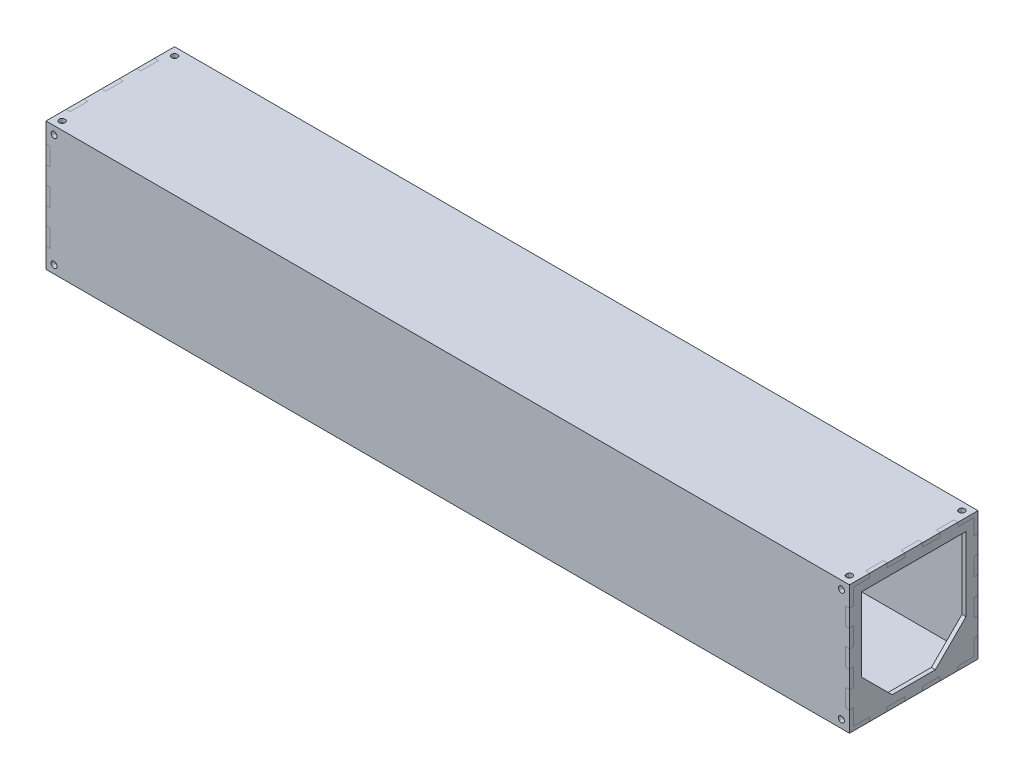
from build123d import *

# Parameters (mm, degrees)
SKETCH1_W           = 101.6
SKETCH1_H           = 101.6
SKETCH1_W_2         = 95.25
SKETCH1_H_2         = 95.25
BOSS_EXTRUDE1_DEPTH = 628.65
SKETCH3_W           = 13.97
SKETCH3_H           = 3.175
SKETCH3_W_2         = 3.175
SKETCH3_H_2         = 13.97
BOSS_EXTRUDE3_DEPTH = 3.175
SKETCH4_W           = 13.97
SKETCH4_H           = 3.175
SKETCH4_W_2         = 3.175
SKETCH4_H_2         = 13.97
BOSS_EXTRUDE4_DEPTH = 3.175
SKETCH5_W           = 95.25
SKETCH5_H           = 95.25
SKETCH5_W_2         = 3.175
SKETCH5_H_2         = 13.97
SKETCH5_W_3         = 13.97
SKETCH5_H_3         = 3.175
BOSS_EXTRUDE5_DEPTH = 3.175
SKETCH6_W           = 3.175
SKETCH6_H           = 13.97
SKETCH6_W_2         = 13.97
SKETCH6_H_2         = 3.175
BOSS_EXTRUDE6_DEPTH = 3.175
SKETCH7_R           = 2.38125
CUT_EXTRUDE1_DEPTH  = 648.956750582
SKETCH8_R           = 2.38125
CUT_EXTRUDE2_DEPTH  = 648.956750582


with BuildPart() as part:
    # Sketch1 → Boss-Extrude1 (new body)
    with BuildSketch(Plane(origin=(0, 0, 0), x_dir=(0, 0, -1), z_dir=(1, 0, 0))):
        with Locations((-50.8, 50.8)):
            Rectangle(SKETCH1_W, SKETCH1_H)
        with Locations((-50.8, 50.8)):
            Rectangle(SKETCH1_W_2, SKETCH1_H_2, mode=Mode.SUBTRACT)
    extrude(amount=BOSS_EXTRUDE1_DEPTH)

    # Sketch3 → Boss-Extrude3 (add)
    with BuildSketch(Plane.ZY):
        Polygon((0, 85.725), (3.175, 85.725), (3.175, 98.425), (15.875, 98.425), (15.875, 101.6), (0, 101.6), align=None)
        with Locations((36.83, 100.0125)):
            Rectangle(SKETCH3_W, SKETCH3_H)
        with Locations((1.5875, 64.77)):
            Rectangle(SKETCH3_W_2, SKETCH3_H_2)
        with Locations((100.0125, 64.77)):
            Rectangle(SKETCH3_W_2, SKETCH3_H_2)
        with Locations((64.77, 100.0125)):
            Rectangle(SKETCH3_W, SKETCH3_H)
        Polygon((98.425, 98.425), (85.725, 98.425), (85.725, 101.6), (101.6, 101.6), (101.6, 85.725), (98.425, 85.725), align=None)
        Polygon((101.6, 15.875), (98.425, 15.875), (98.425, 3.175), (85.725, 3.175), (85.725, 0), (101.6, 0), align=None)
        with Locations((64.77, 1.5875)):
            Rectangle(SKETCH3_W, SKETCH3_H)
        with Locations((100.0125, 36.83)):
            Rectangle(SKETCH3_W_2, SKETCH3_H_2)
        with Locations((1.5875, 36.83)):
            Rectangle(SKETCH3_W_2, SKETCH3_H_2)
        with Locations((36.83, 1.5875)):
            Rectangle(SKETCH3_W, SKETCH3_H)
        Polygon((3.175, 3.175), (15.875, 3.175), (15.875, 0), (0, 0), (0, 15.875), (3.175, 15.875), align=None)
    extrude(amount=BOSS_EXTRUDE3_DEPTH)

    # Sketch6 → Boss-Extrude6 (add)
    with BuildSketch(Plane(origin=(628.65, 0, 0), x_dir=(0, 0, -1), z_dir=(1, 0, 0))):
        with Locations((-100.0125, 36.83)):
            Rectangle(SKETCH6_W, SKETCH6_H)
        with Locations((-100.0125, 64.77)):
            Rectangle(SKETCH6_W, SKETCH6_H)
        Polygon((-98.425, 98.425), (-98.425, 85.725), (-101.6, 85.725), (-101.6, 101.6), (-85.725, 101.6), (-85.725, 98.425), align=None)
        with Locations((-64.77, 100.0125)):
            Rectangle(SKETCH6_W_2, SKETCH6_H_2)
        with Locations((-36.83, 100.0125)):
            Rectangle(SKETCH6_W_2, SKETCH6_H_2)
        Polygon((0, 101.6), (0, 85.725), (-3.175, 85.725), (-3.175, 98.425), (-15.875, 98.425), (-15.875, 101.6), align=None)
        with Locations((-1.5875, 64.77)):
            Rectangle(SKETCH6_W, SKETCH6_H)
        with Locations((-1.5875, 36.83)):
            Rectangle(SKETCH6_W, SKETCH6_H)
        Polygon((-3.175, 3.175), (-3.175, 15.875), (0, 15.875), (0, 0), (-15.875, 0), (-15.875, 3.175), align=None)
        with Locations((-36.83, 1.5875)):
            Rectangle(SKETCH6_W_2, SKETCH6_H_2)
        with Locations((-64.77, 1.5875)):
            Rectangle(SKETCH6_W_2, SKETCH6_H_2)
        Polygon((-101.6, 0), (-101.6, 15.875), (-98.425, 15.875), (-98.425, 3.175), (-85.725, 3.175), (-85.725, 0), align=None)
    extrude(amount=BOSS_EXTRUDE6_DEPTH)

    # Sketch7 → Cut-Extrude1 (cut, through all)
    with BuildSketch(Plane(origin=(0, 0, 0), x_dir=(-1, 0, 0), z_dir=(0, 0, -1))):
        with Locations((-625.475, 95.25)):
            Circle(SKETCH7_R)
        with Locations((-625.475, 6.35)):
            Circle(SKETCH7_R)
        with Locations((-3.175, 95.25)):
            Circle(SKETCH7_R)
        with Locations((-3.175, 6.35)):
            Circle(SKETCH7_R)
    extrude(amount=-CUT_EXTRUDE1_DEPTH, mode=Mode.SUBTRACT)

    # Sketch8 → Cut-Extrude2 (cut, through all)
    with BuildSketch(Plane(origin=(0, 101.6, 0), x_dir=(1, 0, 0), z_dir=(0, 1, 0))):
        with Locations(Location((3.175, -6.35, 0), (0, 0, 270))):
            Circle(SKETCH8_R)
        with Locations(Location((625.475, -6.35, 0), (0, 0, 90))):
            Circle(SKETCH8_R)
        with Locations(Location((625.475, -95.25, 0), (0, 0, 270))):
            Circle(SKETCH8_R)
        with Locations(Location((3.175, -95.25, 0), (0, 0, 90))):
            Circle(SKETCH8_R)
    extrude(amount=-CUT_EXTRUDE2_DEPTH, mode=Mode.SUBTRACT)


with BuildPart() as body_2:
    # Sketch4 → Boss-Extrude4 (new body)
    with BuildSketch(Plane.ZY):
        with Locations((22.86, 100.0125)):
            Rectangle(SKETCH4_W, SKETCH4_H)
        Polygon((3.175, 85.725), (3.175, 98.425), (15.875, 98.425), (29.845, 98.425), (43.815, 98.425), (57.785, 98.425), (71.755, 98.425), (85.725, 98.425), (98.425, 98.425), (98.425, 85.725), (98.425, 71.755), (98.425, 57.785), (98.425, 43.815), (98.425, 29.845), (98.425, 15.875), (98.425, 3.175), (85.725, 3.175), (71.755, 3.175), (57.785, 3.175), (43.815, 3.175), (29.845, 3.175), (15.875, 3.175), (3.175, 3.175), (3.175, 15.875), (3.175, 29.845), (3.175, 43.815), (3.175, 57.785), (3.175, 71.755), align=None)
        with Locations((50.8, 100.0125)):
            Rectangle(SKETCH4_W, SKETCH4_H)
        with Locations((78.74, 100.0125)):
            Rectangle(SKETCH4_W, SKETCH4_H)
        with Locations((100.0125, 78.74)):
            Rectangle(SKETCH4_W_2, SKETCH4_H_2)
        with Locations((100.0125, 50.8)):
            Rectangle(SKETCH4_W_2, SKETCH4_H_2)
        with Locations((100.0125, 22.86)):
            Rectangle(SKETCH4_W_2, SKETCH4_H_2)
        with Locations((78.74, 1.5875)):
            Rectangle(SKETCH4_W, SKETCH4_H)
        with Locations((50.8, 1.5875)):
            Rectangle(SKETCH4_W, SKETCH4_H)
        with Locations((22.86, 1.5875)):
            Rectangle(SKETCH4_W, SKETCH4_H)
        with Locations((1.5875, 22.86)):
            Rectangle(SKETCH4_W_2, SKETCH4_H_2)
        with Locations((1.5875, 50.8)):
            Rectangle(SKETCH4_W_2, SKETCH4_H_2)
        with Locations((1.5875, 78.74)):
            Rectangle(SKETCH4_W_2, SKETCH4_H_2)
    extrude(amount=BOSS_EXTRUDE4_DEPTH)


with BuildPart() as body_3:
    # Sketch5 → Boss-Extrude5 (new body)
    # profile 1 of 13: a face of its own
    with BuildSketch(Plane(origin=(628.65, 0, 0), x_dir=(0, 0, -1), z_dir=(1, 0, 0))):
        with Locations((-50.8, 50.8)):
            Rectangle(SKETCH5_W, SKETCH5_H)
        Polygon((-92.075, 92.075), (-9.525, 92.075), (-9.525, 33.703335213), (-33.703335213, 9.525), (-67.896664787, 9.525), (-92.075, 33.703335213), align=None, mode=Mode.SUBTRACT)
    # profile 2 of 13: a face of its own
    with BuildSketch(Plane(origin=(628.65, 0, 0), x_dir=(0, 0, -1), z_dir=(1, 0, 0))):
        with Locations((-100.0125, 22.86)):
            Rectangle(SKETCH5_W_2, SKETCH5_H_2)
    # profile 3 of 13: a face of its own
    with BuildSketch(Plane(origin=(628.65, 0, 0), x_dir=(0, 0, -1), z_dir=(1, 0, 0))):
        with Locations((-100.0125, 50.8)):
            Rectangle(SKETCH5_W_2, SKETCH5_H_2)
    # profile 4 of 13: a face of its own
    with BuildSketch(Plane(origin=(628.65, 0, 0), x_dir=(0, 0, -1), z_dir=(1, 0, 0))):
        with Locations((-100.0125, 78.74)):
            Rectangle(SKETCH5_W_2, SKETCH5_H_2)
    # profile 5 of 13: a face of its own
    with BuildSketch(Plane(origin=(628.65, 0, 0), x_dir=(0, 0, -1), z_dir=(1, 0, 0))):
        with Locations((-78.74, 100.0125)):
            Rectangle(SKETCH5_W_3, SKETCH5_H_3)
    # profile 6 of 13: a face of its own
    with BuildSketch(Plane(origin=(628.65, 0, 0), x_dir=(0, 0, -1), z_dir=(1, 0, 0))):
        with Locations((-50.8, 100.0125)):
            Rectangle(SKETCH5_W_3, SKETCH5_H_3)
    # profile 7 of 13: a face of its own
    with BuildSketch(Plane(origin=(628.65, 0, 0), x_dir=(0, 0, -1), z_dir=(1, 0, 0))):
        with Locations((-22.86, 100.0125)):
            Rectangle(SKETCH5_W_3, SKETCH5_H_3)
    # profile 8 of 13: a face of its own
    with BuildSketch(Plane(origin=(628.65, 0, 0), x_dir=(0, 0, -1), z_dir=(1, 0, 0))):
        with Locations((-1.5875, 78.74)):
            Rectangle(SKETCH5_W_2, SKETCH5_H_2)
    # profile 9 of 13: a face of its own
    with BuildSketch(Plane(origin=(628.65, 0, 0), x_dir=(0, 0, -1), z_dir=(1, 0, 0))):
        with Locations((-1.5875, 50.8)):
            Rectangle(SKETCH5_W_2, SKETCH5_H_2)
    # profile 10 of 13: a face of its own
    with BuildSketch(Plane(origin=(628.65, 0, 0), x_dir=(0, 0, -1), z_dir=(1, 0, 0))):
        with Locations((-1.5875, 22.86)):
            Rectangle(SKETCH5_W_2, SKETCH5_H_2)
    # profile 11 of 13: a face of its own
    with BuildSketch(Plane(origin=(628.65, 0, 0), x_dir=(0, 0, -1), z_dir=(1, 0, 0))):
        with Locations((-22.86, 1.5875)):
            Rectangle(SKETCH5_W_3, SKETCH5_H_3)
    # profile 12 of 13: a face of its own
    with BuildSketch(Plane(origin=(628.65, 0, 0), x_dir=(0, 0, -1), z_dir=(1, 0, 0))):
        with Locations((-50.8, 1.5875)):
            Rectangle(SKETCH5_W_3, SKETCH5_H_3)
    # profile 13 of 13: a face of its own
    with BuildSketch(Plane(origin=(628.65, 0, 0), x_dir=(0, 0, -1), z_dir=(1, 0, 0))):
        with Locations((-78.74, 1.5875)):
            Rectangle(SKETCH5_W_3, SKETCH5_H_3)
    extrude(amount=BOSS_EXTRUDE5_DEPTH)


solid = Compound([part.part, body_2.part, body_3.part])
